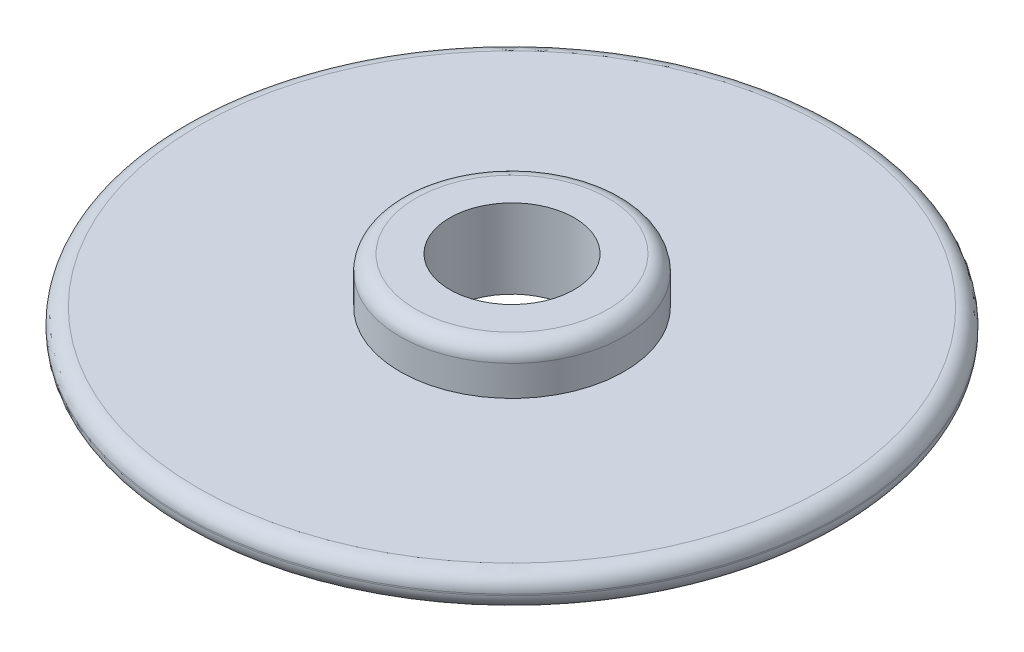
from build123d import *

# Parameters (mm, degrees)
SKETCH1_R           = 15.875
SKETCH1_R_2         = 3
BOSS_EXTRUDE1_DEPTH = 3.81
CUT_EXTRUDE1_START  = -2.2225
SKETCH2_R           = 15.875
SKETCH2_R_2         = 5.3975
CUT_EXTRUDE1_DEPTH  = 2.2225
FILLET1_R           = 0.762


with BuildPart() as part:
    # Sketch1 → Boss-Extrude1 (new body)
    with BuildSketch(Plane(origin=(0, 0, 0), x_dir=(1, 0, 0), z_dir=(0, 1, 0))):
        with Locations(Location((0, 0, 0), (0, 0, 90))):
            Circle(SKETCH1_R)
        with Locations(Location((0, 0, 0), (0, 0, 90))):
            Circle(SKETCH1_R_2, mode=Mode.SUBTRACT)
    extrude(amount=BOSS_EXTRUDE1_DEPTH)

    # Sketch2 → Cut-Extrude1 (cut)
    with BuildSketch(Plane(origin=(0, 3.81, 0), x_dir=(1, 0, 0), z_dir=(0, 1, 0)).offset(CUT_EXTRUDE1_START)):
        with Locations(Location((0, 0, 0), (0, 0, 90))):
            Circle(SKETCH2_R)
        with Locations(Location((0, 0, 0), (0, 0, 270))):
            Circle(SKETCH2_R_2, mode=Mode.SUBTRACT)
    extrude(amount=CUT_EXTRUDE1_DEPTH, mode=Mode.SUBTRACT)

    # Fillet1
    fillet1_edges = [part.edges().sort_by_distance(p)[0] for p in [
        (0, 3.81, -5.3975),
        (0, 1.5875, 15.875),
        (0, 0, 15.875),
    ]]
    fillet(fillet1_edges, radius=FILLET1_R)


solid = part.part
